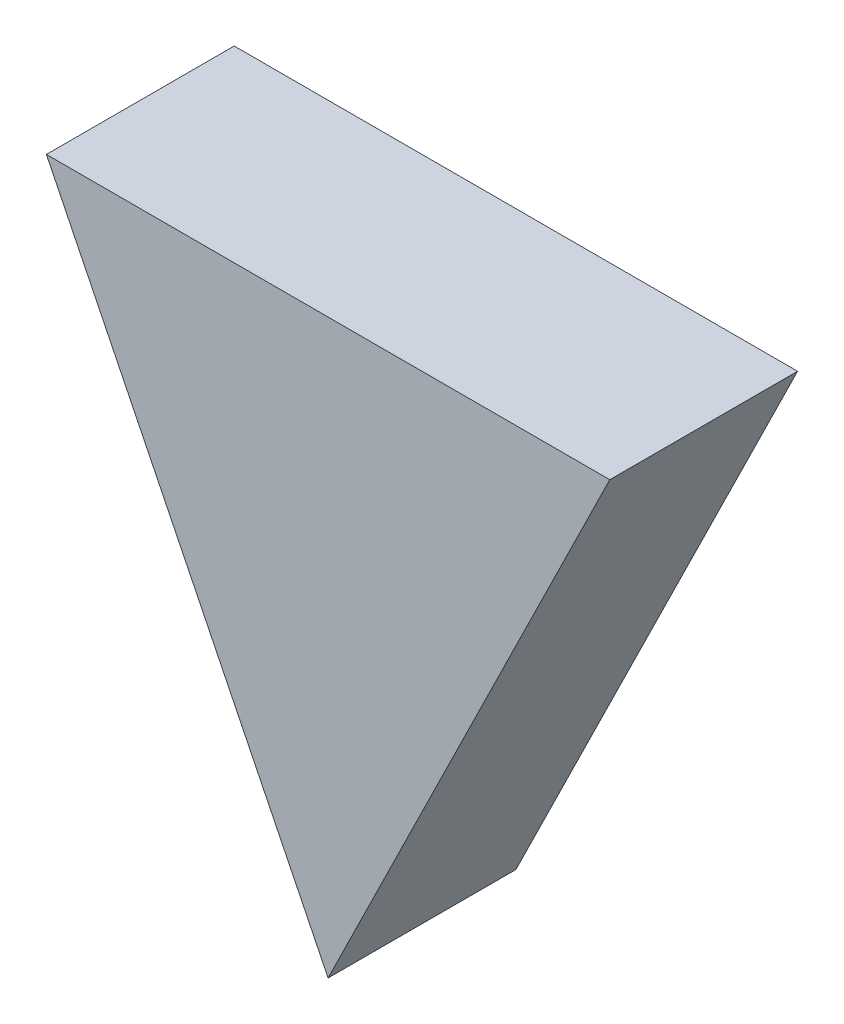
from build123d import *

# Parameters (mm, degrees)
BOSS_EXTRUDE2_DEPTH = 10


with BuildPart() as part:
    # Sketch2 → Boss-Extrude2 (new body)
    with BuildSketch(Plane.XY):
        Polygon((0, 0), (15, 30.48), (-15, 30.48), align=None)
    extrude(amount=BOSS_EXTRUDE2_DEPTH)


solid = part.part
